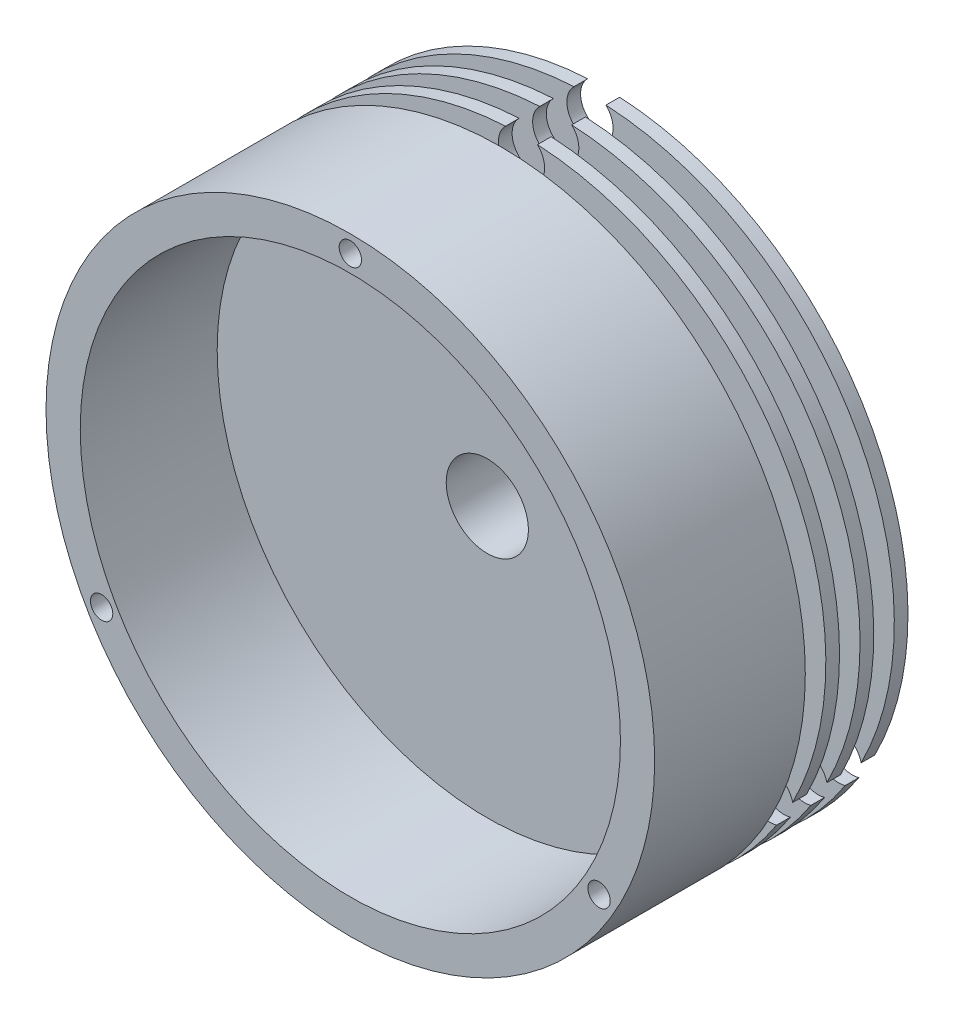
from build123d import *

# Parameters (mm, degrees)
SKETCH1_R                                           = 44.45
SKETCH1_R_2                                         = 39.45
BOSS_EXTRUDE1_DEPTH                                 = 20
BOSS_EXTRUDE2_START                                 = 20
SKETCH4_R                                           = 44.45
SKETCH4_R_2                                         = 6
BOSS_EXTRUDE2_DEPTH                                 = 20
SKETCH5_R                                           = 44.45
SKETCH5_R_2                                         = 33.45
CUT_EXTRUDE1_DEPTH                                  = 3
LPATTERN1_COUNT                                     = 4
LPATTERN1_PITCH                                     = 5
CBORE_FOR_4_BINDING_HEAD_MACHINE_SCREW3_D           = 3.2639
CBORE_FOR_4_BINDING_HEAD_MACHINE_SCREW3_CBORE_D     = 6.74624
CBORE_FOR_4_BINDING_HEAD_MACHINE_SCREW3_CBORE_DEPTH = 14.4272
CIRPATTERN2_COUNT                                   = 3


with BuildPart() as part:
    # Sketch1 → Boss-Extrude1 (new body)
    with BuildSketch(Plane.XY):
        Circle(SKETCH1_R)
        Circle(SKETCH1_R_2, mode=Mode.SUBTRACT)
    extrude(amount=BOSS_EXTRUDE1_DEPTH)

    # Sketch4 → Boss-Extrude2 (add)
    with BuildSketch(Plane(origin=(0, 0, 0), x_dir=(-1, 0, 0), z_dir=(0, 0, -1)).offset(BOSS_EXTRUDE2_START)):
        Circle(SKETCH4_R)
        Circle(SKETCH4_R_2, mode=Mode.SUBTRACT)
    extrude(amount=-BOSS_EXTRUDE2_DEPTH)

    # Sketch5 → Cut-Extrude1 (cut)
    with BuildSketch(Plane(origin=(0, 0, -20), x_dir=(-1, 0, 0), z_dir=(0, 0, -1))):
        Circle(SKETCH5_R)
        Circle(SKETCH5_R_2, mode=Mode.SUBTRACT)
    cut_extrude1 = extrude(amount=-CUT_EXTRUDE1_DEPTH, mode=Mode.SUBTRACT)

    # LPattern1: Cut-Extrude1 ×4
    with Locations(*[(0, 0, i * LPATTERN1_PITCH) for i in range(1, LPATTERN1_COUNT)]):
        add(cut_extrude1, mode=Mode.SUBTRACT)

    # CBORE for #4 Binding Head Machine Screw3 (through all)
    with Locations(Plane(origin=(0, 0, -17), x_dir=(-1, 0, 0), z_dir=(0, 0, -1))):
        with Locations((0, 41.95)):
            cbore_for_4_binding_head_machine_screw3 = CounterBoreHole(CBORE_FOR_4_BINDING_HEAD_MACHINE_SCREW3_D / 2, CBORE_FOR_4_BINDING_HEAD_MACHINE_SCREW3_CBORE_D / 2, CBORE_FOR_4_BINDING_HEAD_MACHINE_SCREW3_CBORE_DEPTH)

    # CirPattern2: CBORE for #4 Binding Head Machine Screw3 ×3 about axis
    cirpattern2_axis = Axis((0, 0, 0), (0, 0, 1))
    for i in range(1, CIRPATTERN2_COUNT):
        add(cbore_for_4_binding_head_machine_screw3.rotate(cirpattern2_axis, i * 360 / CIRPATTERN2_COUNT), mode=Mode.SUBTRACT)


solid = part.part
